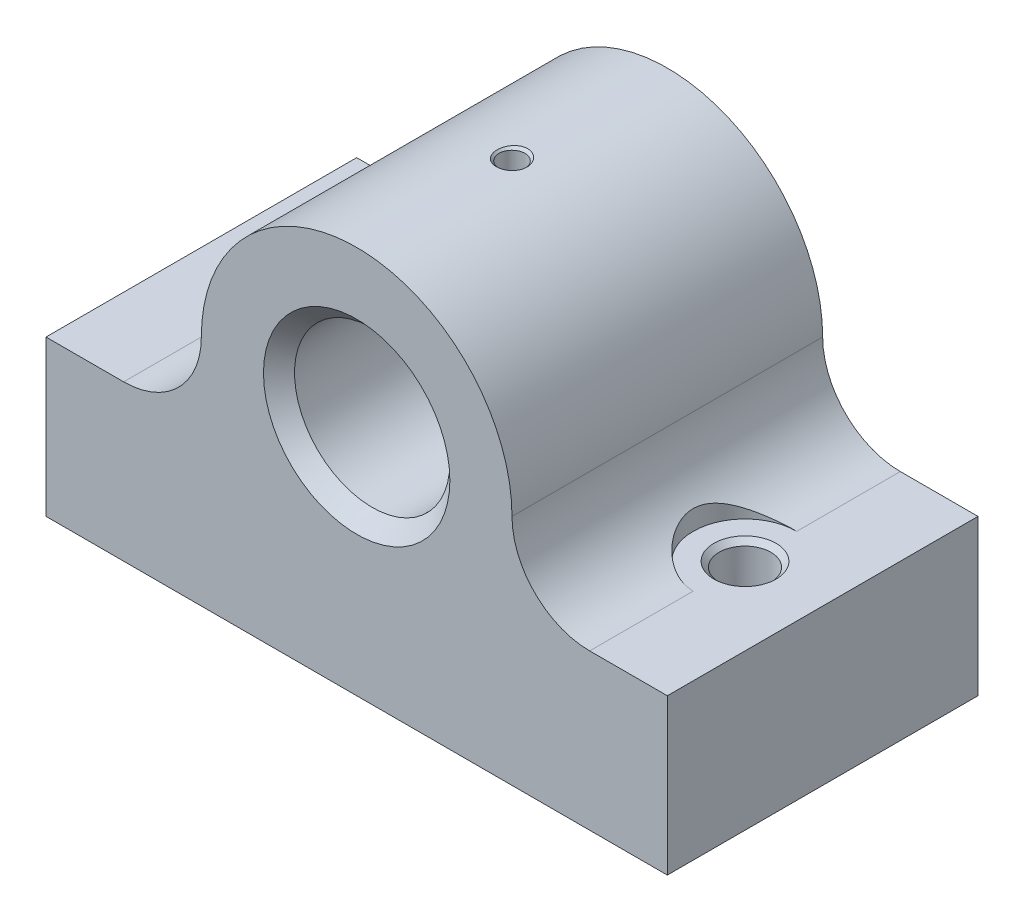
from build123d import *

# Parameters (mm, degrees)
SKETCH2_W                   = 120
SKETCH2_H                   = 60
BOSS_EXTRUDE1_DEPTH         = 30
SKETCH4_R                   = 30
BOSS_EXTRUDE2_DEPTH         = 60
SKETCH6_R                   = 15
CUT_EXTRUDE1_DEPTH          = 114.247516529
CHAMFER1_SIZE               = 3
FILLET2_R                   = 15
SKETCH8_R                   = 10
CUT_EXTRUDE3_DEPTH          = 38
SKETCH9_R                   = 5
CUT_EXTRUDE4_DEPTH          = 81.777472144
CHAMFER2_SIZE               = 1
M6_TAPPED_HOLE2_D           = 5
M6_TAPPED_HOLE2_DEPTH       = 29.999
M6_TAPPED_HOLE2_CSINK_D     = 6.05
M6_TAPPED_HOLE2_CSINK_ANGLE = 90
M6_TAPPED_HOLE2_TIP         = 1.502151548


with BuildPart() as part:
    # Sketch2 → Boss-Extrude1 (new body)
    with BuildSketch(Plane(origin=(0, 0, 0), x_dir=(1, 0, 0), z_dir=(0, 1, 0))):
        Rectangle(SKETCH2_W, SKETCH2_H)
    extrude(amount=BOSS_EXTRUDE1_DEPTH)

    # Sketch4 → Boss-Extrude2 (add)
    with BuildSketch(Plane.XY.offset(30)):
        with Locations((0, 45)):
            Circle(SKETCH4_R)
    extrude(amount=-BOSS_EXTRUDE2_DEPTH)

    # Sketch6 → Cut-Extrude1 (cut, through all)
    with BuildSketch(Plane.XY.offset(30)):
        with Locations((0, 45)):
            Circle(SKETCH6_R)
    extrude(amount=-CUT_EXTRUDE1_DEPTH, mode=Mode.SUBTRACT)

    # Chamfer1
    chamfer1_edges = [part.edges().sort_by_distance(p)[0] for p in [
        (-15, 45, -30),
        (-15, 45, 30),
    ]]
    chamfer(chamfer1_edges, length=CHAMFER1_SIZE)

    # Fillet2
    fillet2_edges = [part.edges().sort_by_distance(p)[0] for p in [
        (-25.980762114, 30, 0),
        (25.980762114, 30, 0),
    ]]
    fillet(fillet2_edges, radius=FILLET2_R)

    # Sketch8 → Cut-Extrude3 (cut)
    with BuildSketch(Plane(origin=(0, 30, 0), x_dir=(1, 0, 0), z_dir=(0, 1, 0))):
        with Locations((-45, 0)):
            Circle(SKETCH8_R)
        with Locations((45, 0)):
            Circle(SKETCH8_R)
    extrude(amount=CUT_EXTRUDE3_DEPTH, mode=Mode.SUBTRACT)

    # Sketch9 → Cut-Extrude4 (cut, through all)
    with BuildSketch(Plane(origin=(0, 30, 0), x_dir=(1, 0, 0), z_dir=(0, 1, 0))):
        with Locations(Location((-45, 0, 0), (0, 0, 270))):
            Circle(SKETCH9_R)
        with Locations(Location((45, 0, 0), (0, 0, 270))):
            Circle(SKETCH9_R)
    extrude(amount=-CUT_EXTRUDE4_DEPTH, mode=Mode.SUBTRACT)

    # Chamfer2
    chamfer2_edges = [part.edges().sort_by_distance(p)[0] for p in [
        (-45, 30, -5),
        (45, 30, -5),
    ]]
    chamfer(chamfer2_edges, length=CHAMFER2_SIZE)

    # M6 Tapped Hole2
    with Locations(Plane(origin=(0, 75, 0), x_dir=(1, 0, 0), z_dir=(0, 1, 0))):
        with Locations((0, 0)):
            CounterSinkHole(M6_TAPPED_HOLE2_D / 2, M6_TAPPED_HOLE2_CSINK_D / 2, depth=M6_TAPPED_HOLE2_DEPTH, counter_sink_angle=M6_TAPPED_HOLE2_CSINK_ANGLE)
            with Locations((0, 0, -(M6_TAPPED_HOLE2_DEPTH + M6_TAPPED_HOLE2_TIP / 2))):  # 118° drill point
                Cone(0, M6_TAPPED_HOLE2_D / 2, M6_TAPPED_HOLE2_TIP, mode=Mode.SUBTRACT)


solid = part.part
